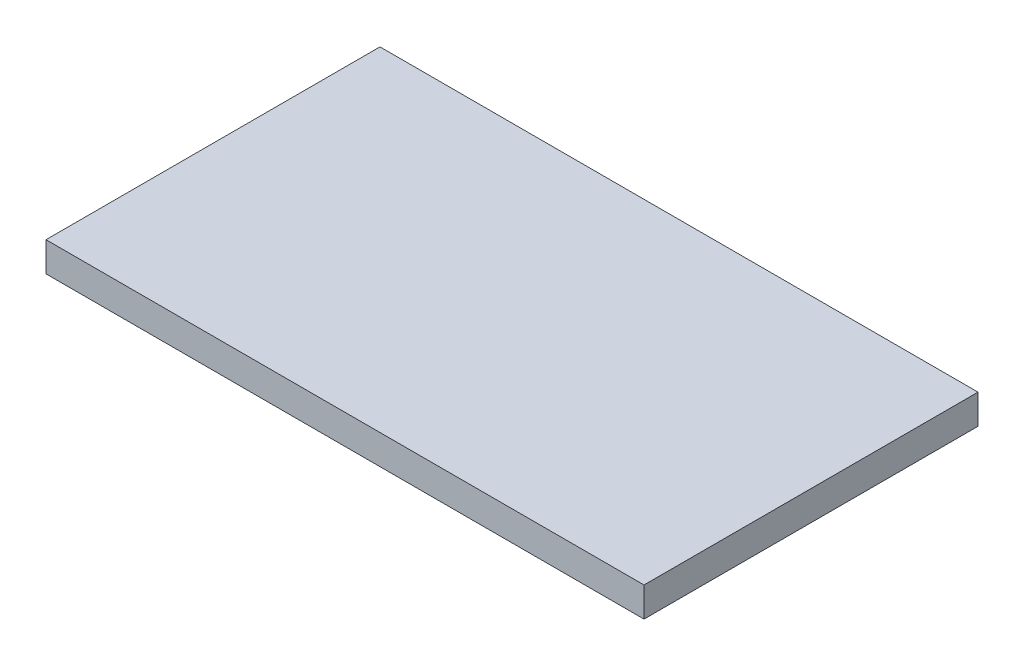
from build123d import *

# Parameters (mm, degrees)
BOSS_EXTRUDE1_DEPTH = 226


with BuildPart() as part:
    # Sketch1 → Boss-Extrude1 (new body)
    with BuildSketch(Plane.XY):
        Polygon((161.15, -33.1), (-161.15, -33.1), (-202.337265555, -33.1), (-202.337265555, -53.131468062), (202.337523688, -53.131468062), (202.337523688, -33.1), align=None)
    extrude(amount=BOSS_EXTRUDE1_DEPTH)


solid = part.part
